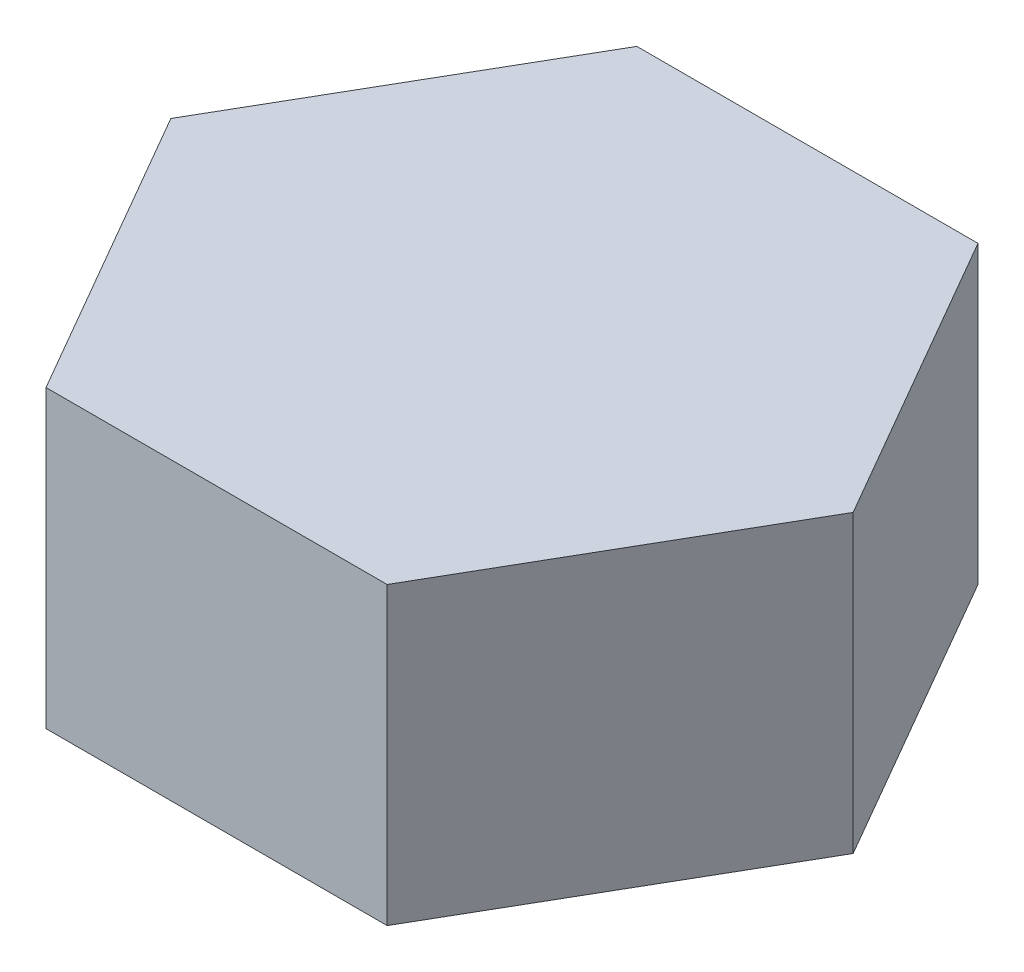
from build123d import *

# Parameters (mm, degrees)
SKETCH2_R           = 3
BOSS_EXTRUDE2_DEPTH = 2.5


with BuildPart() as part:
    # Sketch2 → Boss-Extrude2 (new, symmetric)
    # profile 1 of 2: a face of its own
    with BuildSketch(Plane(origin=(0, 0, 0), x_dir=(1, 0, 0), z_dir=(0, 1, 0))):
        Polygon((-2.886751346, -5), (2.886751346, -5), (5.773502692, 0), (2.886751346, 5), (-2.886751346, 5), (-5.773502692, 0), align=None)
        Circle(SKETCH2_R, mode=Mode.SUBTRACT)
    # profile 2 of 2: a face of its own
    with BuildSketch(Plane(origin=(0, 0, 0), x_dir=(1, 0, 0), z_dir=(0, 1, 0))):
        Circle(SKETCH2_R)
    extrude(amount=BOSS_EXTRUDE2_DEPTH, both=True)


solid = part.part
